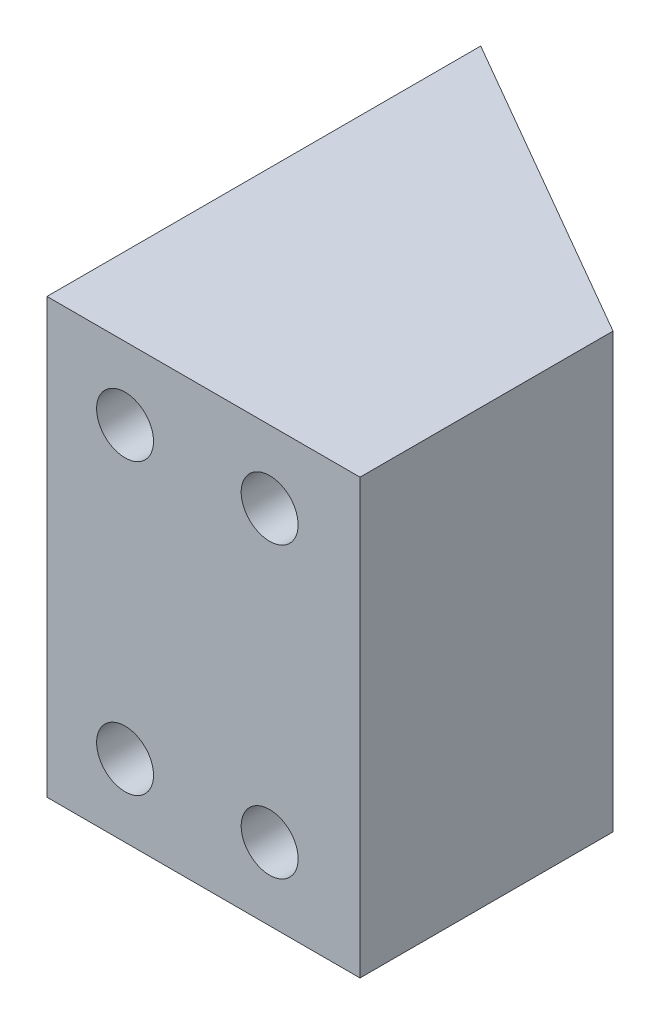
from build123d import *

# Parameters (mm, degrees)
BOSS_EXTRUDE1_DEPTH = 48
SKETCH3_R           = 4.1
CUT_EXTRUDE1_DEPTH  = 41.7
SKETCH4_R           = 3.15
CUT_EXTRUDE2_DEPTH  = 4.7
SKETCH5_R           = 4.1
SKETCH5_R_2         = 2.1
BOSS_EXTRUDE2_DEPTH = 3


with BuildPart() as part:
    # Sketch2 → Boss-Extrude1 (new body)
    with BuildSketch(Plane(origin=(0, 0, 0), x_dir=(1, 0, 0), z_dir=(0, 1, 0))):
        Polygon((0, 0), (0, -20), (0, -48), (34.641016151, -48), (34.641016151, -20), align=None)
    extrude(amount=BOSS_EXTRUDE1_DEPTH)

    # Sketch3 → Cut-Extrude1 (cut)
    with BuildSketch(Plane(origin=(0, 0, 0), x_dir=(-0.8660254037844417, 0, -0.4999999999999947), z_dir=(0.49999999999999484, 0, -0.8660254037844418))):
        with Locations((-7, 40)):
            Circle(SKETCH3_R)
        with Locations((-7, 8)):
            Circle(SKETCH3_R)
    extrude(amount=-CUT_EXTRUDE1_DEPTH, mode=Mode.SUBTRACT)

    # Sketch4 → Cut-Extrude2 (cut)
    with BuildSketch(Plane.XY.offset(48)):
        with Locations((8.641016151, 40)):
            Circle(SKETCH4_R)
        with Locations((24.641016151, 40)):
            Circle(SKETCH4_R)
        with Locations((8.641016151, 8)):
            Circle(SKETCH4_R)
        with Locations((24.641016151, 8)):
            Circle(SKETCH4_R)
    extrude(amount=-CUT_EXTRUDE2_DEPTH, mode=Mode.SUBTRACT)

    # Sketch5 → Boss-Extrude2 (add)
    # profile 1 of 2: a face of its own
    with BuildSketch(Plane(origin=(0, 0, 0), x_dir=(-0.8660254037844417, 0, -0.4999999999999947), z_dir=(0.49999999999999484, 0, -0.8660254037844418))):
        with Locations((-7, 40)):
            Circle(SKETCH5_R)
        with Locations((-7, 40)):
            Circle(SKETCH5_R_2, mode=Mode.SUBTRACT)
    # profile 2 of 2: a face of its own
    with BuildSketch(Plane(origin=(0, 0, 0), x_dir=(-0.8660254037844417, 0, -0.4999999999999947), z_dir=(0.49999999999999484, 0, -0.8660254037844418))):
        with Locations((-7, 8)):
            Circle(SKETCH5_R)
        with Locations((-7, 8)):
            Circle(SKETCH5_R_2, mode=Mode.SUBTRACT)
    extrude(amount=-BOSS_EXTRUDE2_DEPTH)


solid = part.part
